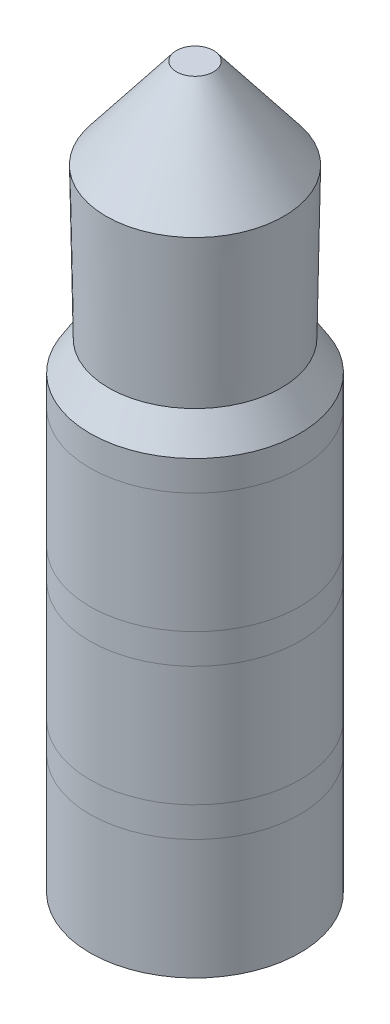
from build123d import *

# Parameters (mm, degrees)
SKETCH1_R           = 1.75
BOSS_EXTRUDE1_DEPTH = 2
SKETCH2_R           = 1.75
BOSS_EXTRUDE2_DEPTH = 0.5
SKETCH3_R           = 1.75
BOSS_EXTRUDE3_DEPTH = 2
SKETCH4_R           = 1.75
BOSS_EXTRUDE4_DEPTH = 0.5
SKETCH5_R           = 1.75
BOSS_EXTRUDE5_DEPTH = 2
SKETCH7_R           = 1.75
BOSS_EXTRUDE6_DEPTH = 0.5
SKETCH8_R           = 1.75
BOSS_EXTRUDE7_DEPTH = 0.5
BOSS_EXTRUDE7_TAPER = 32
SKETCH9_R           = 1.437565324
BOSS_EXTRUDE8_DEPTH = 2.5
BOSS_EXTRUDE8_DRAFT = -1
SKETCH10_R          = 1.481202986
BOSS_EXTRUDE9_DEPTH = 1.5
BOSS_EXTRUDE9_TAPER = 38


with BuildPart() as part:
    # Sketch1 → Boss-Extrude1 (new body)
    with BuildSketch(Plane(origin=(0, 0, 0), x_dir=(1, 0, 0), z_dir=(0, 1, 0))):
        with Locations(Location((0, 0, 0), (0, 0, 270))):
            Circle(SKETCH1_R)
    extrude(amount=BOSS_EXTRUDE1_DEPTH)


with BuildPart() as body_2:
    # Sketch2 → Boss-Extrude2 (new body)
    with BuildSketch(Plane(origin=(0, 2, 0), x_dir=(1, 0, 0), z_dir=(0, 1, 0))):
        with Locations(Location((0, 0, 0), (0, 0, 270))):
            Circle(SKETCH2_R)
    extrude(amount=BOSS_EXTRUDE2_DEPTH)


with BuildPart() as body_3:
    # Sketch3 → Boss-Extrude3 (new body)
    with BuildSketch(Plane(origin=(0, 2.5, 0), x_dir=(1, 0, 0), z_dir=(0, 1, 0))):
        with Locations(Location((0, 0, 0), (0, 0, 270))):
            Circle(SKETCH3_R)
    extrude(amount=BOSS_EXTRUDE3_DEPTH)


with BuildPart() as body_4:
    # Sketch4 → Boss-Extrude4 (new body)
    with BuildSketch(Plane(origin=(0, 4.5, 0), x_dir=(1, 0, 0), z_dir=(0, 1, 0))):
        with Locations(Location((0, 0, 0), (0, 0, 270))):
            Circle(SKETCH4_R)
    extrude(amount=BOSS_EXTRUDE4_DEPTH)


with BuildPart() as body_5:
    # Sketch5 → Boss-Extrude5 (new body)
    with BuildSketch(Plane(origin=(0, 5, 0), x_dir=(1, 0, 0), z_dir=(0, 1, 0))):
        with Locations(Location((0, 0, 0), (0, 0, 270))):
            Circle(SKETCH5_R)
    extrude(amount=BOSS_EXTRUDE5_DEPTH)


with BuildPart() as body_6:
    # Sketch7 → Boss-Extrude6 (new body)
    with BuildSketch(Plane(origin=(0, 7, 0), x_dir=(1, 0, 0), z_dir=(0, 1, 0))):
        with Locations(Location((0, 0, 0), (0, 0, 270))):
            Circle(SKETCH7_R)
    extrude(amount=BOSS_EXTRUDE6_DEPTH)


with BuildPart() as body_7:
    # Sketch8 → Boss-Extrude7 (new body)
    with BuildSketch(Plane(origin=(0, 7.5, 0), x_dir=(1, 0, 0), z_dir=(0, 1, 0))):
        with Locations(Location((0, 0, 0), (0, 0, 270))):
            Circle(SKETCH8_R)
    extrude(amount=BOSS_EXTRUDE7_DEPTH, taper=BOSS_EXTRUDE7_TAPER)


with BuildPart() as boss_extrude8_tool:
    # Sketch9 → Boss-Extrude8 (with draft: the straight prism first)
    with BuildSketch(Plane(origin=(0, 8, 0), x_dir=(1, 0, 0), z_dir=(0, 1, 0))):
        Circle(SKETCH9_R)
    extrude(amount=BOSS_EXTRUDE8_DEPTH)
    # Boss-Extrude8: the draft: its side faces are tilted about the plane it starts from
    boss_extrude8_sides = [boss_extrude8_tool.faces().sort_by_distance(p)[0] for p in [
        (-1.437565324, 9.25, 0),
    ]]
    draft(boss_extrude8_sides, Plane(origin=(0, 8, 0), x_dir=(1, 0, 0), z_dir=(0, 1, 0)), BOSS_EXTRUDE8_DRAFT)


with BuildPart() as body_7_1:
    add(body_7.part)

    # Boss-Extrude8: add boss_extrude8_tool
    add(boss_extrude8_tool.part)

    # Sketch10 → Boss-Extrude9 (add)
    with BuildSketch(Plane(origin=(0, 10.5, 0), x_dir=(1, 0, 0), z_dir=(0, 1, 0))):
        Circle(SKETCH10_R)
    extrude(amount=BOSS_EXTRUDE9_DEPTH, taper=BOSS_EXTRUDE9_TAPER)


solid = Compound([part.part, body_2.part, body_3.part, body_4.part, body_5.part, body_6.part, body_7_1.part])
